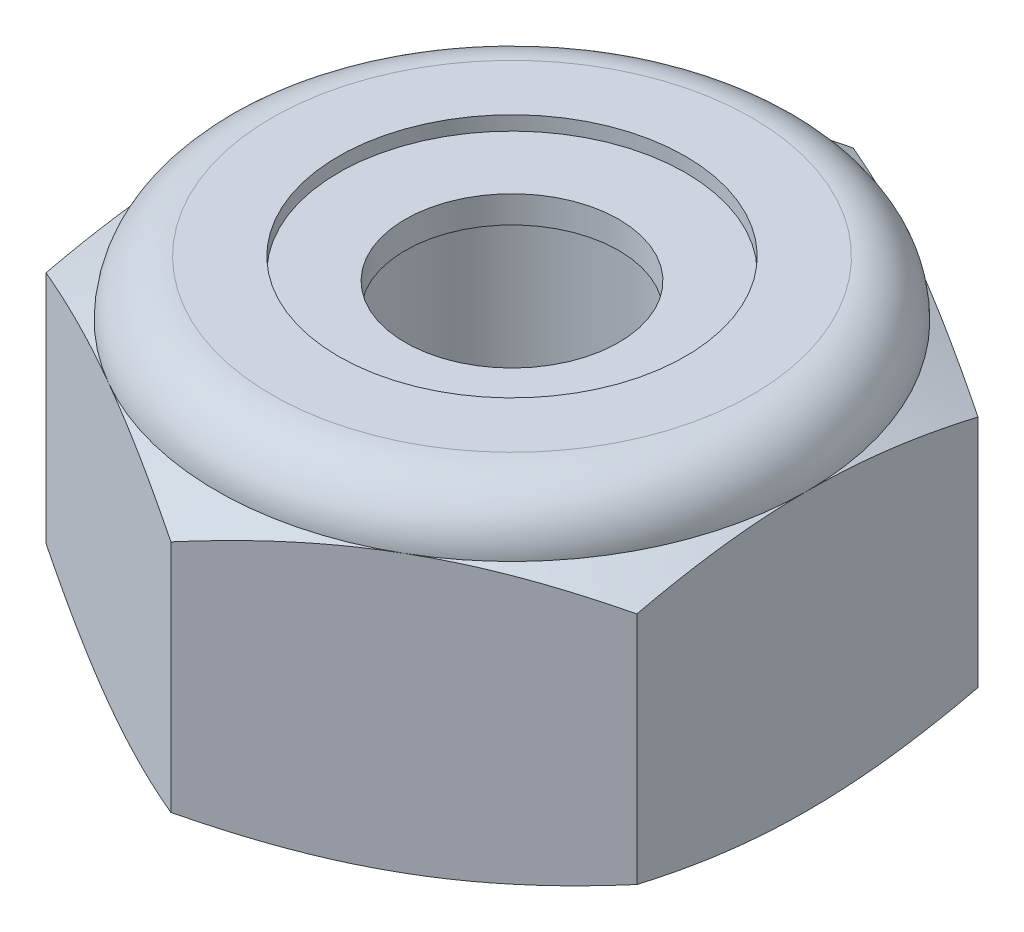
from build123d import *

# Parameters (mm, degrees)
EXTRUDE1_DEPTH = 3.571875
SKETCH2_W      = 1.4224
SKETCH2_H      = 3.571875


with BuildPart() as part:
    # Sketch1 → Extrude1 (new body)
    with BuildSketch(Plane(origin=(0, 0, 0), x_dir=(1, 0, 0), z_dir=(0, 1, 0))):
        Polygon((0, 3.666174209), (-3.175, 1.833087105), (-3.175, -1.833087105), (0, -3.666174209), (3.175, -1.833087105), (3.175, 1.833087105), align=None)
    extrude(amount=EXTRUDE1_DEPTH)

    # Sketch4 → Cut-Revolve2 (revolve, cut)
    with BuildSketch(Plane(origin=(0, 0, 0), x_dir=(0, 0, -1), z_dir=(1, 0, 0))):
        Polygon((0, 3.571875), (1.4224, 3.571875), (1.147473684, 3.443674754), (1.147473684, 0.128200246), (1.4224, 0), (0, 0), align=None)
    revolve(axis=Axis((0, 3.571875, 0), (0, 1, 0)), mode=Mode.SUBTRACT)


with BuildPart() as body_2:
    # Sketch2 → Revolve1 (revolve)
    with BuildSketch(Plane(origin=(0, 0, 0), x_dir=(0, 0, -1), z_dir=(1, 0, 0))):
        with Locations((0.7112, 1.7859375)):
            Rectangle(SKETCH2_W, SKETCH2_H)
    revolve(axis=Axis((0, -1.4224, 0), (0, 1, 0)))


with BuildPart() as part_1:
    add(part.part)

    # Combine1: cut body 2
    add(body_2.part, mode=Mode.SUBTRACT)

    # Sketch5 → Cut-Revolve3 (revolve, cut)
    with BuildSketch(Plane(origin=(0, 0, 0), x_dir=(0, 0, -1), z_dir=(1, 0, 0))):
        with BuildLine():
            Line((0, 0), (3.175, 0))
            Line((3.175, 0), (3.666174209, 0.229038295))
            Line((3.666174209, 0.229038295), (3.666174209, 2.747524205))
            Line((3.666174209, 2.747524205), (3.175, 2.9765625))
            ThreePointArc((3.175, 2.9765625), (3.000637006, 3.397512006), (2.5796875, 3.571875))
            Line((2.5796875, 3.571875), (2.5796875, 4.841875))
            Line((2.5796875, 4.841875), (4.936174209, 4.841875))
            Line((4.936174209, 4.841875), (4.936174209, -1.27))
            Line((4.936174209, -1.27), (0, -1.27))
            Line((0, -1.27), (0, 0))
        make_face()
    revolve(axis=Axis((0, 0, 0), (0, 1, 0)), mode=Mode.SUBTRACT)

    # Sketch6 → Cut-Revolve4 (revolve, cut)
    with BuildSketch(Plane(origin=(0, 0, 0), x_dir=(0, 0, -1), z_dir=(1, 0, 0))):
        with BuildLine():
            Line((0, 2.9765625), (3.0226, 2.9765625))
            ThreePointArc((3.0226, 2.9765625), (2.892873932, 3.289748932), (2.5796875, 3.419475))
            Line((2.5796875, 3.419475), (1.863580592, 3.419475))
            Line((1.863580592, 3.419475), (1.863580592, 4.841875))
            Line((1.863580592, 4.841875), (0, 4.841875))
            Line((0, 4.841875), (0, 2.9765625))
        make_face()
    revolve(axis=Axis((0, 4.841875, 0), (0, 1, 0)), mode=Mode.SUBTRACT)


with BuildPart() as body_2_2:
    # Sketch7 → Revolve2 (revolve)
    with BuildSketch(Plane(origin=(0, 0, 0), x_dir=(0, 0, -1), z_dir=(1, 0, 0))):
        with BuildLine():
            Line((1.147473684, 3.0527625), (2.938395763, 3.0527625))
            ThreePointArc((2.938395763, 3.0527625), (2.810484559, 3.261537543), (2.5796875, 3.343275))
            Line((2.5796875, 3.343275), (1.147473684, 3.343275))
            Line((1.147473684, 3.343275), (1.147473684, 3.0527625))
        make_face()
    revolve(axis=Axis((0, 3.0527625, 0), (0, 1, 0)))


solid = Compound([part_1.part, body_2_2.part])
